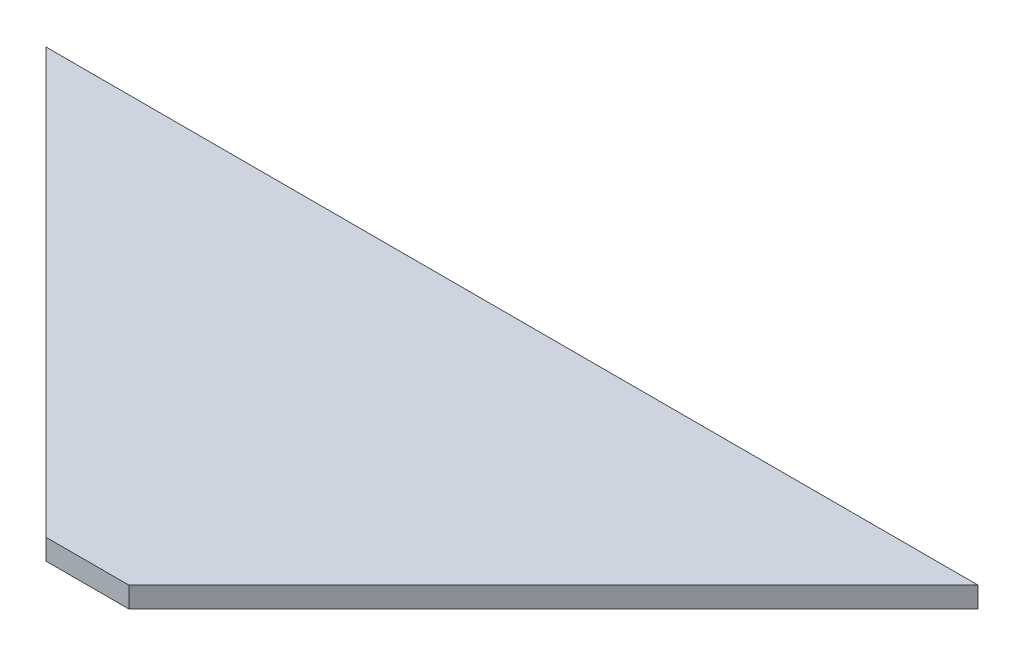
from build123d import *

# Parameters (mm, degrees)
SCREEN_TRIANGLE_DEPTH = 1


with BuildPart() as part:
    # Sketch1 → Screen triangle (new body)
    with BuildSketch(Plane(origin=(0, 0, 0), x_dir=(1, 0, 0), z_dir=(0, 1, 0))):
        Polygon((-22.5, 22.5), (22.5, 22.5), (2, 2), (-2, 2), align=None)
    extrude(amount=SCREEN_TRIANGLE_DEPTH)


solid = part.part
